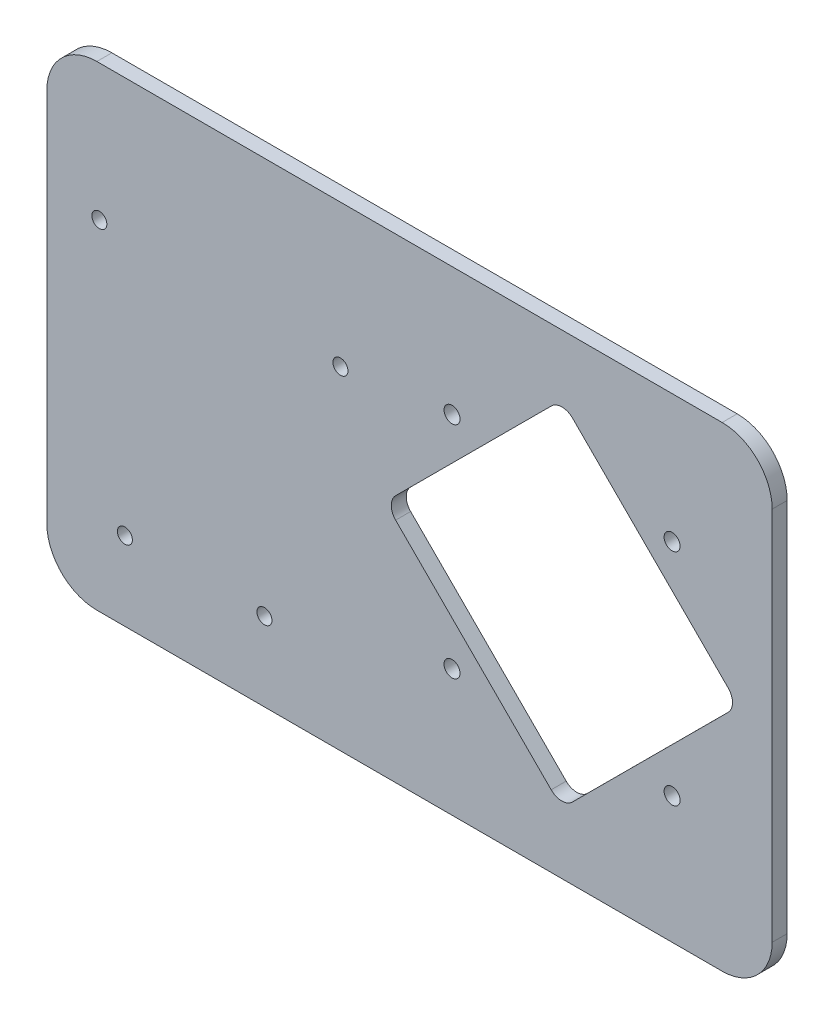
from build123d import *

# Parameters (mm, degrees)
SKETCH_1_R          = 1.5
EXTRUDE_1_DEPTH     = 3
SKETCH_2_R          = 1.6
CUT_EXTRUDE_1_DEPTH = 296.563476419


with BuildPart() as part:
    # 草图1 → 凸台-拉伸1 (new body)
    with BuildSketch(Plane(origin=(0, 0, 0), x_dir=(-1, 0, 0), z_dir=(0, 0, -1))):
        with BuildLine():
            Line((-269.068, 2.31372), (-144.068, 2.31372))
            ThreePointArc((-144.068, 2.31372), (-136.996932188, 5.242652188), (-134.068, 12.31372))
            Line((-134.068, 12.31372), (-134.068, 87.313))
            ThreePointArc((-134.068, 87.313), (-136.996932188, 94.384067812), (-144.068, 97.313))
            Line((-144.068, 97.313), (-269.068, 97.313))
            ThreePointArc((-269.068, 97.313), (-276.139067812, 94.384067812), (-279.068, 87.313))
            Line((-279.068, 87.313), (-279.068, 12.31372))
            ThreePointArc((-279.068, 12.31372), (-276.139067812, 5.242652188), (-269.068, 2.31372))
        make_face()
        with Locations(Location((-144.568, 70.12826533, 0), (0, 0, 180))):
            Circle(SKETCH_1_R, mode=Mode.SUBTRACT)
        with Locations(Location((-192.767, 68.82896533, 0), (0, 0, 180))):
            Circle(SKETCH_1_R, mode=Mode.SUBTRACT)
        with Locations(Location((-149.668, 18.02876533, 0), (0, 0, 180))):
            Circle(SKETCH_1_R, mode=Mode.SUBTRACT)
        with Locations(Location((-215.068, 71.68966533, 0), (0, 0, 180))):
            Circle(SKETCH_1_R, mode=Mode.SUBTRACT)
        with Locations(Location((-259.067, 71.68966533, 0), (0, 0, 180))):
            Circle(SKETCH_1_R, mode=Mode.SUBTRACT)
        with Locations(Location((-259.067, 27.68886533, 0), (0, 0, 180))):
            Circle(SKETCH_1_R, mode=Mode.SUBTRACT)
        with Locations(Location((-215.068, 27.68886533, 0), (0, 0, 180))):
            Circle(SKETCH_1_R, mode=Mode.SUBTRACT)
        with Locations(Location((-177.568, 18.02876533, 0), (0, 0, 180))):
            Circle(SKETCH_1_R, mode=Mode.SUBTRACT)
        with BuildLine():
            Line((-270.266244411, 51.969241805), (-239.172302587, 83.100283559))
            ThreePointArc((-239.172302587, 83.100283559), (-237.051506509, 83.980227838), (-234.929662654, 83.102813116))
            Line((-234.929662654, 83.102813116), (-203.798358898, 52.008609603))
            ThreePointArc((-203.798358898, 52.008609603), (-202.918414619, 49.887813524), (-203.795829341, 47.765969669))
            Line((-203.795829341, 47.765969669), (-234.889771164, 16.634927916))
            ThreePointArc((-234.889771164, 16.634927916), (-237.010567242, 15.754983637), (-239.132411097, 16.632398358))
            Line((-239.132411097, 16.632398358), (-270.263714853, 47.726601872))
            ThreePointArc((-270.263714853, 47.726601872), (-271.143659132, 49.84739795), (-270.266244411, 51.969241805))
        make_face(mode=Mode.SUBTRACT)
    extrude(amount=-EXTRUDE_1_DEPTH)

    # 草图2 → 切除-拉伸1 (cut, through all)
    with BuildSketch(Plane.XY.offset(3)):
        with Locations((259.067, 71.68966533)):
            Circle(SKETCH_2_R)
        with Locations((215.068, 71.68966533)):
            Circle(SKETCH_2_R)
        with Locations((215.068, 27.68886533)):
            Circle(SKETCH_2_R)
        with Locations((259.067, 27.68886533)):
            Circle(SKETCH_2_R)
    extrude(amount=-CUT_EXTRUDE_1_DEPTH, mode=Mode.SUBTRACT)


solid = part.part
